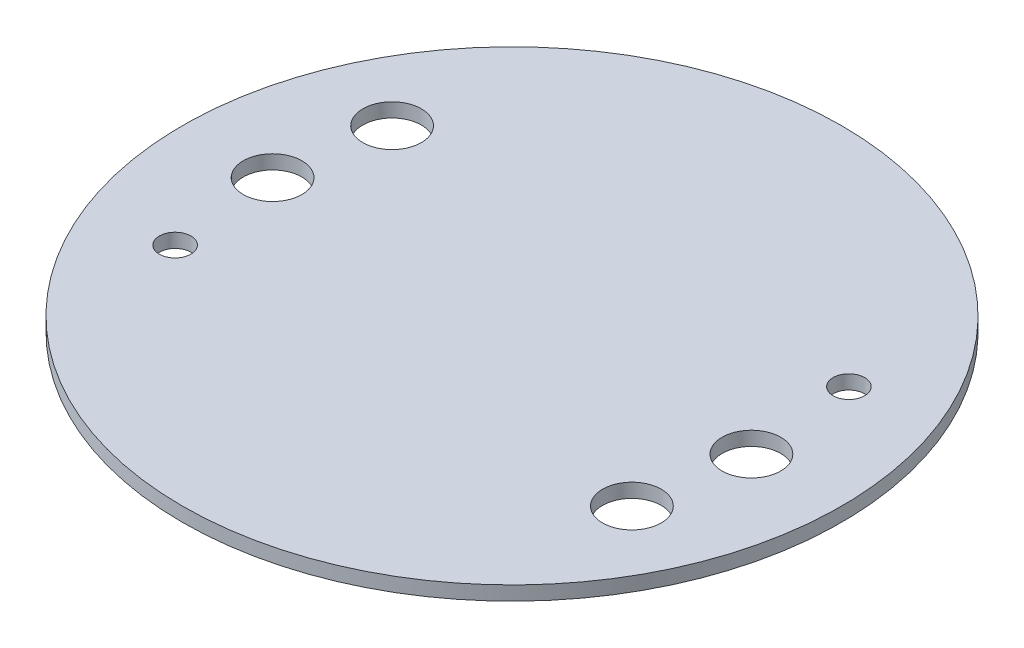
from build123d import *

# Parameters (mm, degrees)
SKETCH1_R           = 74.295
BOSS_EXTRUDE1_DEPTH = 3.175
SKETCH2_R           = 3.556
SKETCH2_R_2         = 6.604
CUT_EXTRUDE1_DEPTH  = 3.175


with BuildPart() as part:
    # Sketch1 → Boss-Extrude1 (new body)
    with BuildSketch(Plane(origin=(0, 0, 0), x_dir=(1, 0, 0), z_dir=(0, 1, 0))):
        with Locations(Location((0, 0, 0), (0, 0, 270))):
            Circle(SKETCH1_R)
    extrude(amount=BOSS_EXTRUDE1_DEPTH)

    # Sketch2 → Cut-Extrude1 (cut)
    with BuildSketch(Plane(origin=(0, 3.175, 0), x_dir=(1, 0, 0), z_dir=(0, 1, 0))):
        with Locations(Location((-51.795490029, -24.152633658, 0), (0, 0, 270))):
            Circle(SKETCH2_R)
        with Locations(Location((51.795490029, 24.152633658, 0), (0, 0, 270))):
            Circle(SKETCH2_R)
        with Locations(Location((-53.975, 0, 0), (0, 0, 270))):
            Circle(SKETCH2_R_2)
        with Locations(Location((53.975, 0, 0), (0, 0, 270))):
            Circle(SKETCH2_R_2)
        with Locations(Location((50.64447914, -23.615908466, 0), (0, 0, 270))):
            Circle(SKETCH2_R_2)
        with Locations(Location((-50.64447914, 23.615908466, 0), (0, 0, 270))):
            Circle(SKETCH2_R_2)
    extrude(amount=-CUT_EXTRUDE1_DEPTH, mode=Mode.SUBTRACT)


solid = part.part
